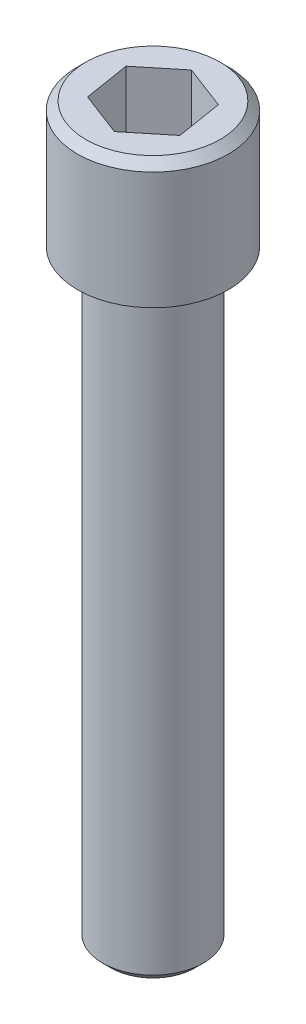
from build123d import *

# Parameters (mm, degrees)
SKICA1_R                 = 1.5
P_IDAT_VYSUNUT_M1_DEPTH  = 18
SKICA2_R                 = 2.25
P_IDAT_VYSUNUT_M2_DEPTH  = 3.75
ODEBRAT_VYSUNUT_M1_DEPTH = 2.25
ZKOSEN_1_SIZE            = 0.25
ZKOSEN_2_SIZE            = 0.25


with BuildPart() as part:
    # Skica1 → Přidat vysunutím1 (new body)
    with BuildSketch(Plane(origin=(0, 0, 0), x_dir=(1, 0, 0), z_dir=(0, 1, 0))):
        with Locations(Location((0, 0, 0), (0, 0, 270))):
            Circle(SKICA1_R)
    extrude(amount=P_IDAT_VYSUNUT_M1_DEPTH)

    # Skica2 → Přidat vysunutím2 (add)
    with BuildSketch(Plane(origin=(0, 18, 0), x_dir=(1, 0, 0), z_dir=(0, 1, 0))):
        with Locations(Location((0, 0, 0), (0, 0, 270))):
            Circle(SKICA2_R)
    extrude(amount=P_IDAT_VYSUNUT_M2_DEPTH)

    # Skica3 → Odebrat vysunutím1 (cut)
    with BuildSketch(Plane(origin=(0, 21.75, 0), x_dir=(1, 0, 0), z_dir=(0, 1, 0))):
        Polygon((-1.074402598, -0.875019461), (0.220587783, -1.367969674), (1.294990381, -0.492950213), (1.074402598, 0.875019461), (-0.220587783, 1.367969674), (-1.294990381, 0.492950213), align=None)
    extrude(amount=-ODEBRAT_VYSUNUT_M1_DEPTH, mode=Mode.SUBTRACT)

    # Zkosení1
    zkosen_1_edges = [part.edges().sort_by_distance(p)[0] for p in [
        (0, 21.75, -2.25),
    ]]
    chamfer(zkosen_1_edges, length=ZKOSEN_1_SIZE)

    # Zkosení2
    zkosen_2_edges = [part.edges().sort_by_distance(p)[0] for p in [
        (0, 0, -1.5),
    ]]
    chamfer(zkosen_2_edges, length=ZKOSEN_2_SIZE)


solid = part.part
